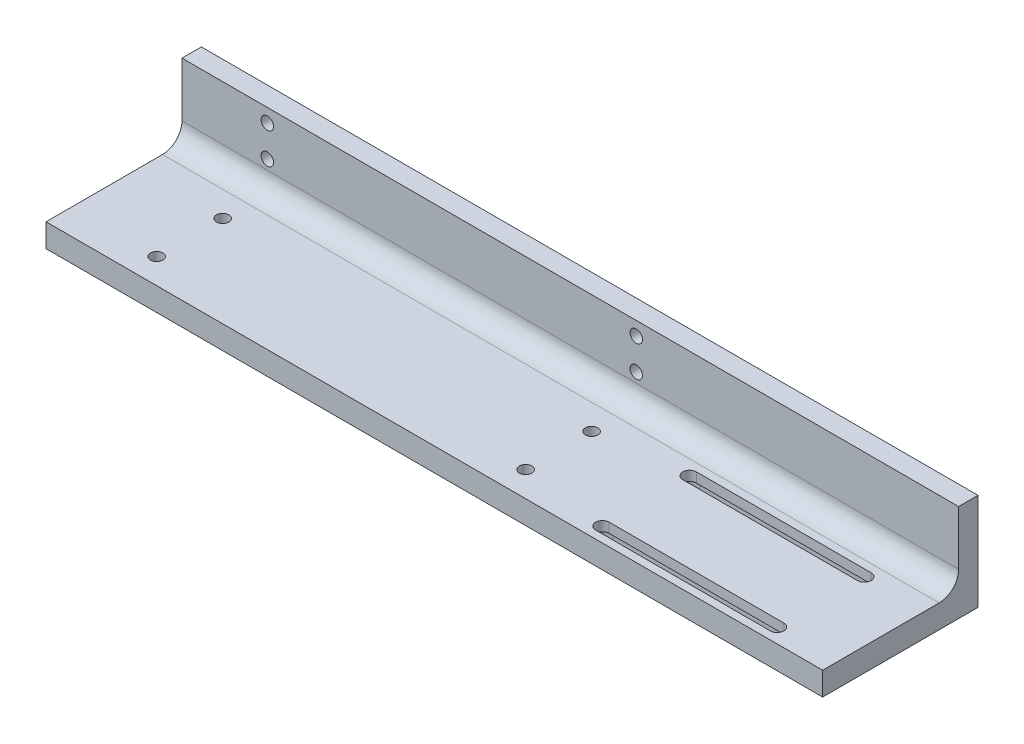
from build123d import *

# Parameters (mm, degrees)
BOSS_EXTRUDE8_DEPTH = 200
SKETCH4_R           = 1.6
CUT_EXTRUDE1_DEPTH  = 2.5
CUT_EXTRUDE2_START  = -3.5
SKETCH5_R           = 1.6
CUT_EXTRUDE2_DEPTH  = 3.5
SKETCH7_R           = 1.6
CUT_EXTRUDE3_DEPTH  = 5


with BuildPart() as part:
    # Sketch6 → Boss-Extrude8 (new body)
    with BuildSketch(Plane(origin=(0, 0, 0), x_dir=(0, 0, -1), z_dir=(1, 0, 0))):
        with BuildLine():
            Line((0, 2.5), (30, 2.5))
            ThreePointArc((30, 2.5), (33.535533906, 3.964466094), (35, 7.5))
            Line((35, 7.5), (35, 21.5))
            Line((35, 21.5), (40, 21.5))
            Line((40, 21.5), (40, -3.5))
            Line((40, -3.5), (0, -3.5))
            Line((0, -3.5), (0, 2.5))
        make_face()
    extrude(amount=BOSS_EXTRUDE8_DEPTH)

    # Sketch4 → Cut-Extrude1 (cut)
    with BuildSketch(Plane(origin=(0, 0, 0), x_dir=(1, 0, 0), z_dir=(0, 1, 0))):
        with Locations(Location((22, 23.5, 0), (0, 0, 90))):
            Circle(SKETCH4_R)
        with Locations(Location((22, 6.5, 0), (0, 0, 90))):
            Circle(SKETCH4_R)
        with Locations(Location((117, 23.5, 0), (0, 0, 90))):
            Circle(SKETCH4_R)
        with Locations(Location((117, 6.5, 0), (0, 0, 90))):
            Circle(SKETCH4_R)
        with BuildLine():
            Line((139.5, 27.975), (184.5, 27.975))
            ThreePointArc((184.5, 27.975), (186.25, 26.225), (184.5, 24.475))
            Line((184.5, 24.475), (139.5, 24.475))
            ThreePointArc((139.5, 24.475), (137.75, 26.225), (139.5, 27.975))
        make_face()
        with BuildLine():
            Line((139.5, 5.525), (184.5, 5.525))
            ThreePointArc((184.5, 5.525), (186.25, 3.775), (184.5, 2.025))
            Line((184.5, 2.025), (139.5, 2.025))
            ThreePointArc((139.5, 2.025), (137.75, 3.775), (139.5, 5.525))
        make_face()
    extrude(amount=CUT_EXTRUDE1_DEPTH, mode=Mode.SUBTRACT)

    # Sketch5 → Cut-Extrude2 (cut)
    with BuildSketch(Plane(origin=(0, 0, 0), x_dir=(1, 0, 0), z_dir=(0, 1, 0)).offset(CUT_EXTRUDE2_START)):
        with Locations(Location((22, 23.5, 0), (0, 0, 90))):
            Circle(SKETCH5_R)
        with Locations(Location((22, 6.5, 0), (0, 0, 90))):
            Circle(SKETCH5_R)
        with Locations(Location((117, 23.5, 0), (0, 0, 90))):
            Circle(SKETCH5_R)
        with Locations(Location((117, 6.5, 0), (0, 0, 90))):
            Circle(SKETCH5_R)
        with BuildLine():
            Line((184.5, 23.475), (139.5, 23.475))
            ThreePointArc((139.5, 23.475), (136.75, 26.225), (139.5, 28.975))
            Line((139.5, 28.975), (184.5, 28.975))
            ThreePointArc((184.5, 28.975), (187.25, 26.225), (184.5, 23.475))
        make_face()
        with BuildLine():
            Line((184.5, 1.025), (139.5, 1.025))
            ThreePointArc((139.5, 1.025), (136.75, 3.775), (139.5, 6.525))
            Line((139.5, 6.525), (184.5, 6.525))
            ThreePointArc((184.5, 6.525), (187.25, 3.775), (184.5, 1.025))
        make_face()
    extrude(amount=CUT_EXTRUDE2_DEPTH, mode=Mode.SUBTRACT)

    # Sketch7 → Cut-Extrude3 (cut)
    with BuildSketch(Plane.XY.offset(-35)):
        with Locations((22, 10)):
            Circle(SKETCH7_R)
        with Locations((22, 18)):
            Circle(SKETCH7_R)
        with Locations((117, 10)):
            Circle(SKETCH7_R)
        with Locations((117, 18)):
            Circle(SKETCH7_R)
    extrude(amount=-CUT_EXTRUDE3_DEPTH, mode=Mode.SUBTRACT)


solid = part.part
